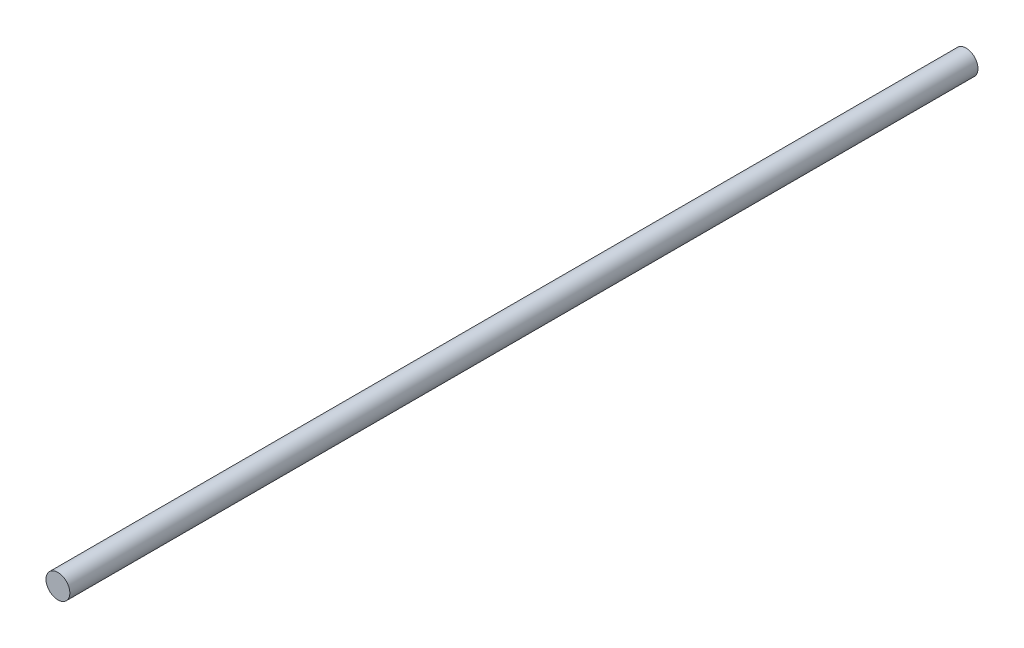
from build123d import *

# Parameters (mm, degrees)
SKETCH1_R           = 3.95
BOSS_EXTRUDE1_DEPTH = 300.7


with BuildPart() as part:
    # Sketch1 → Boss-Extrude1 (new body)
    with BuildSketch(Plane.XY):
        Circle(SKETCH1_R)
    extrude(amount=BOSS_EXTRUDE1_DEPTH)


solid = part.part
